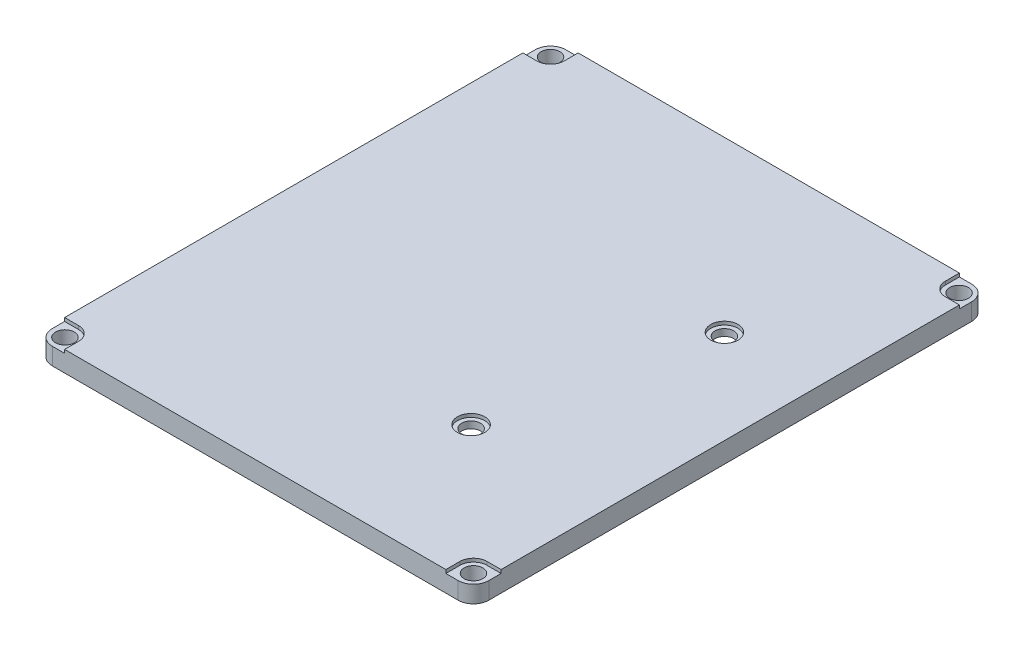
from build123d import *

# Parameters (mm, degrees)
BASE_DEPTH          = 3
SKETCH2_W           = 57
SKETCH2_H           = 68.2942
SHELL_DEPTH         = 1.5
SKETCH3_R           = 1.375
THROUGH_HOLES_DEPTH = 70.842801106
SKETCH6_R           = 1.375
SKETCH6_R_2         = 2
SOCKET_HOLES_DEPTH  = 0.5
SKETCH7_W           = 8.5
SKETCH7_H           = 8.5
BOSS_EXTRUDE2_DEPTH = 2.8
BOSS_EXTRUDE3_DEPTH = 4.1
SKETCH9_W           = 4.9
SKETCH9_H           = 3.32367647
BOSS_EXTRUDE4_DEPTH = 6.028194003
SKETCH10_W          = 2.805255888
SKETCH10_H          = 4.105255888
BOSS_EXTRUDE5_DEPTH = 6.5752


with BuildPart() as part:
    # Sketch1 → Base (new body)
    with BuildSketch(Plane(origin=(0, 26.414945084, 0), x_dir=(1, 0, 0), z_dir=(0, 1, 0))):
        with BuildLine():
            Line((-4.892059596, -40.449863775), (54.607940404, -40.449863775))
            ThreePointArc((54.607940404, -40.449863775), (56.198930662, -39.790854032), (56.857940404, -38.199863775))
            Line((56.857940404, -38.199863775), (56.857940404, 32.594336225))
            ThreePointArc((56.857940404, 32.594336225), (56.198930662, 34.185326483), (54.607940404, 34.844336225))
            Line((54.607940404, 34.844336225), (-4.892059596, 34.844336225))
            ThreePointArc((-4.892059596, 34.844336225), (-6.483049854, 34.185326483), (-7.142059596, 32.594336225))
            Line((-7.142059596, 32.594336225), (-7.142059596, -38.199863775))
            ThreePointArc((-7.142059596, -38.199863775), (-6.483049854, -39.790854032), (-4.892059596, -40.449863775))
        make_face()
    extrude(amount=BASE_DEPTH)

    # Sketch2 → Shell (cut)
    with BuildSketch(Plane.XZ.offset(-26.414945084)):
        with Locations((24.857940404, 2.802763775)):
            Rectangle(SKETCH2_W, SKETCH2_H)
    extrude(amount=-SHELL_DEPTH, mode=Mode.SUBTRACT)

    # Sketch3 → Through Holes (cut, through all)
    with BuildSketch(Plane(origin=(0, 29.414945084, 0), x_dir=(1, 0, 0), z_dir=(0, 1, 0))):
        with Locations(Location((-5.091807064, 32.794083694, 0), (0, 0, 180))):
            Circle(SKETCH3_R)
        with Locations(Location((54.807687872, 32.794083694, 0), (0, 0, 180))):
            Circle(SKETCH3_R)
        with Locations(Location((43.107940404, 10.094336225, 0), (0, 0, 180))):
            Circle(SKETCH3_R)
        with Locations(Location((36.257940404, -20.199611243, 0), (0, 0, 180))):
            Circle(SKETCH3_R)
        with Locations(Location((54.807687872, -38.399611243, 0), (0, 0, 180))):
            Circle(SKETCH3_R)
        with Locations(Location((-5.091807064, -38.399611243, 0), (0, 0, 180))):
            Circle(SKETCH3_R)
    extrude(amount=-THROUGH_HOLES_DEPTH, mode=Mode.SUBTRACT)

    # Sketch6 → Socket Holes (cut)
    # profile 1 of 6: a face of its own
    with BuildSketch(Plane(origin=(0, 29.414945084, 0), x_dir=(1, 0, 0), z_dir=(0, 1, 0))):
        with BuildLine():
            ThreePointArc((-7.142059596, -38.199863775), (-6.483049854, -39.790854032), (-4.892059596, -40.449863775))
            Line((-4.892059596, -40.449863775), (-3.091807064, -40.449863775))
            Line((-3.091807064, -40.449863775), (-3.091807064, -38.399611243))
            ThreePointArc((-3.091807064, -38.399611243), (-3.677593502, -36.98539768), (-5.091807064, -36.399611243))
            Line((-5.091807064, -36.399611243), (-7.142059596, -36.399611243))
            Line((-7.142059596, -36.399611243), (-7.142059596, -38.199863775))
        make_face()
        with Locations(Location((-5.091807064, -38.399611243, 0), (0, 0, 180))):
            Circle(SKETCH6_R, mode=Mode.SUBTRACT)
    # profile 2 of 6: a face of its own
    with BuildSketch(Plane(origin=(0, 29.414945084, 0), x_dir=(1, 0, 0), z_dir=(0, 1, 0))):
        with Locations(Location((36.257940404, -20.199611243, 0), (0, 0, 180))):
            Circle(SKETCH6_R_2)
        with Locations(Location((36.257940404, -20.199611243, 0), (0, 0, 180))):
            Circle(SKETCH6_R, mode=Mode.SUBTRACT)
    # profile 3 of 6: a face of its own
    with BuildSketch(Plane(origin=(0, 29.414945084, 0), x_dir=(1, 0, 0), z_dir=(0, 1, 0))):
        with BuildLine():
            Line((52.807687872, -38.399611243), (52.807687872, -40.449863775))
            Line((52.807687872, -40.449863775), (54.607940404, -40.449863775))
            ThreePointArc((54.607940404, -40.449863775), (56.198930662, -39.790854032), (56.857940404, -38.199863775))
            Line((56.857940404, -38.199863775), (56.857940404, -36.399611243))
            Line((56.857940404, -36.399611243), (54.807687872, -36.399611243))
            ThreePointArc((54.807687872, -36.399611243), (53.39347431, -36.98539768), (52.807687872, -38.399611243))
        make_face()
        with Locations(Location((54.807687872, -38.399611243, 0), (0, 0, 180))):
            Circle(SKETCH6_R, mode=Mode.SUBTRACT)
    # profile 4 of 6: a face of its own
    with BuildSketch(Plane(origin=(0, 29.414945084, 0), x_dir=(1, 0, 0), z_dir=(0, 1, 0))):
        with Locations(Location((43.107940404, 10.094336225, 0), (0, 0, 180))):
            Circle(SKETCH6_R_2)
        with Locations(Location((43.107940404, 10.094336225, 0), (0, 0, 180))):
            Circle(SKETCH6_R, mode=Mode.SUBTRACT)
    # profile 5 of 6: a face of its own
    with BuildSketch(Plane(origin=(0, 29.414945084, 0), x_dir=(1, 0, 0), z_dir=(0, 1, 0))):
        with BuildLine():
            Line((54.807687872, 30.794083694), (56.857940404, 30.794083694))
            Line((56.857940404, 30.794083694), (56.857940404, 32.594336225))
            ThreePointArc((56.857940404, 32.594336225), (56.198930662, 34.185326483), (54.607940404, 34.844336225))
            Line((54.607940404, 34.844336225), (52.807687872, 34.844336225))
            Line((52.807687872, 34.844336225), (52.807687872, 32.794083694))
            ThreePointArc((52.807687872, 32.794083694), (53.39347431, 31.379870131), (54.807687872, 30.794083694))
        make_face()
        with Locations(Location((54.807687872, 32.794083694, 0), (0, 0, 180))):
            Circle(SKETCH6_R, mode=Mode.SUBTRACT)
    # profile 6 of 6: a face of its own
    with BuildSketch(Plane(origin=(0, 29.414945084, 0), x_dir=(1, 0, 0), z_dir=(0, 1, 0))):
        with BuildLine():
            Line((-7.142059596, 32.594336225), (-7.142059596, 30.794083694))
            Line((-7.142059596, 30.794083694), (-5.091807064, 30.794083694))
            ThreePointArc((-5.091807064, 30.794083694), (-3.677593502, 31.379870131), (-3.091807064, 32.794083694))
            Line((-3.091807064, 32.794083694), (-3.091807064, 34.844336225))
            Line((-3.091807064, 34.844336225), (-4.892059596, 34.844336225))
            ThreePointArc((-4.892059596, 34.844336225), (-6.483049854, 34.185326483), (-7.142059596, 32.594336225))
        make_face()
        with Locations(Location((-5.091807064, 32.794083694, 0), (0, 0, 180))):
            Circle(SKETCH6_R, mode=Mode.SUBTRACT)
    extrude(amount=-SOCKET_HOLES_DEPTH, mode=Mode.SUBTRACT)

    # Sketch7 → Boss-Extrude2 (add)
    with BuildSketch(Plane.XZ.offset(-27.914945084)):
        with Locations((8.757575778, 30.275109563)):
            Rectangle(SKETCH7_W, SKETCH7_H)
    extrude(amount=BOSS_EXTRUDE2_DEPTH)

    # Sketch8 → Boss-Extrude3 (add)
    with BuildSketch(Plane.XZ.offset(-27.914945084)):
        with BuildLine():
            Line((26.274319641, 23.450802906), (26.274319641, 20.79902621))
            ThreePointArc((26.274319641, 20.79902621), (25.981426422, 20.091919429), (25.274319641, 19.79902621))
            Line((25.274319641, 19.79902621), (17.388533203, 19.79902621))
            Line((17.388533203, 19.79902621), (15.974319641, 21.213239773))
            Line((15.974319641, 21.213239773), (15.974319641, 23.450802906))
            Line((15.974319641, 23.450802906), (15.974319641, 26.350802906))
            Line((15.974319641, 26.350802906), (15.974319641, 28.588366038))
            Line((15.974319641, 28.588366038), (17.034979813, 29.64902621))
            Line((17.034979813, 29.64902621), (24.860106079, 29.64902621))
            Line((24.860106079, 29.64902621), (26.274319641, 28.234812648))
            Line((26.274319641, 28.234812648), (26.274319641, 26.350802906))
            Line((26.274319641, 26.350802906), (26.274319641, 23.450802906))
        make_face()
    extrude(amount=BOSS_EXTRUDE3_DEPTH)

    # Sketch9 → Boss-Extrude4 (add)
    with BuildSketch(Plane.XZ.offset(-27.914945084)):
        with Locations((6.478182604, 6.956579663)):
            Rectangle(SKETCH9_W, SKETCH9_H)
    extrude(amount=BOSS_EXTRUDE4_DEPTH)

    # Sketch10 → Boss-Extrude5 (add)
    with BuildSketch(Plane.XZ.offset(-27.914945084)):
        with Locations((17.740823979, 9.706286862)):
            Rectangle(SKETCH10_W, SKETCH10_H)
    extrude(amount=BOSS_EXTRUDE5_DEPTH)


solid = part.part
